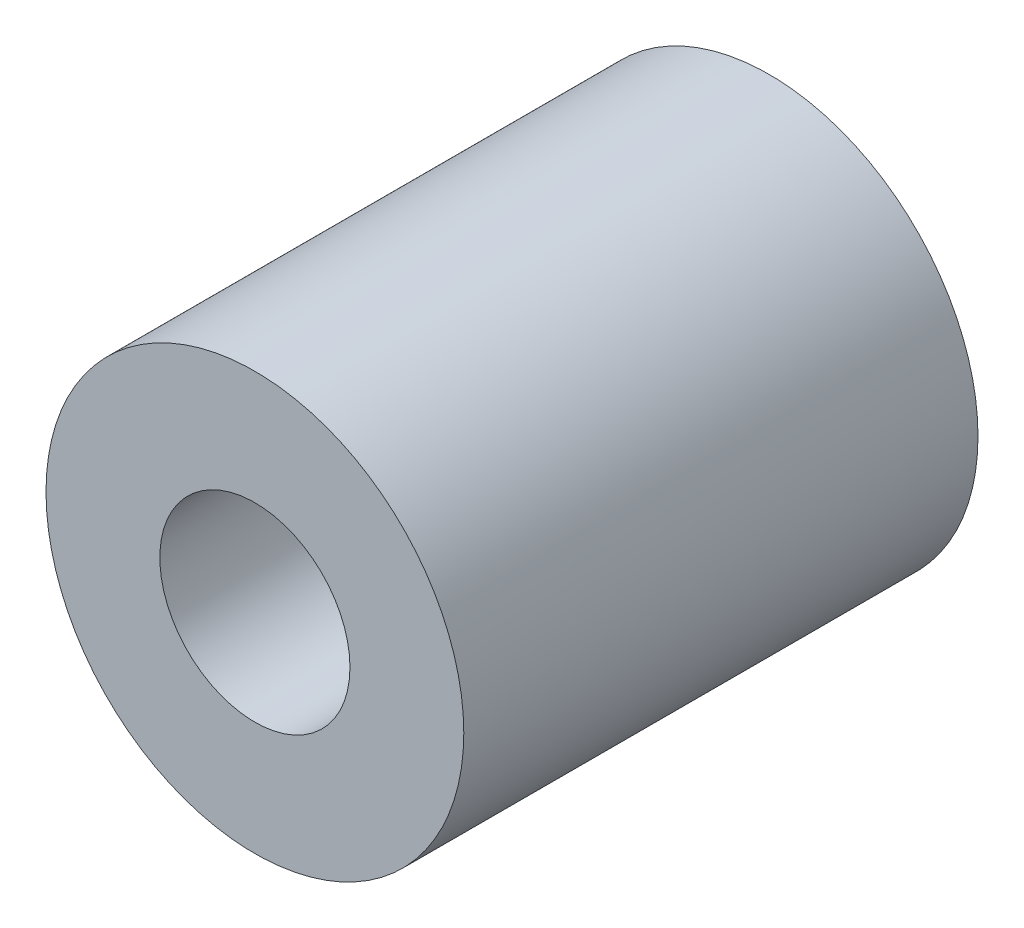
from build123d import *

# Parameters (mm, degrees)
IZIM1_R                     = 3.9
IZIM1_R_2                   = 1.775
Y_KSEKLIK_EKSTR_ZYON1_DEPTH = 9.6


with BuildPart() as part:
    # Çizim1 → Yükseklik-Ekstrüzyon1 (new body)
    with BuildSketch(Plane.XY):
        Circle(IZIM1_R)
        Circle(IZIM1_R_2, mode=Mode.SUBTRACT)
    extrude(amount=Y_KSEKLIK_EKSTR_ZYON1_DEPTH)


solid = part.part
